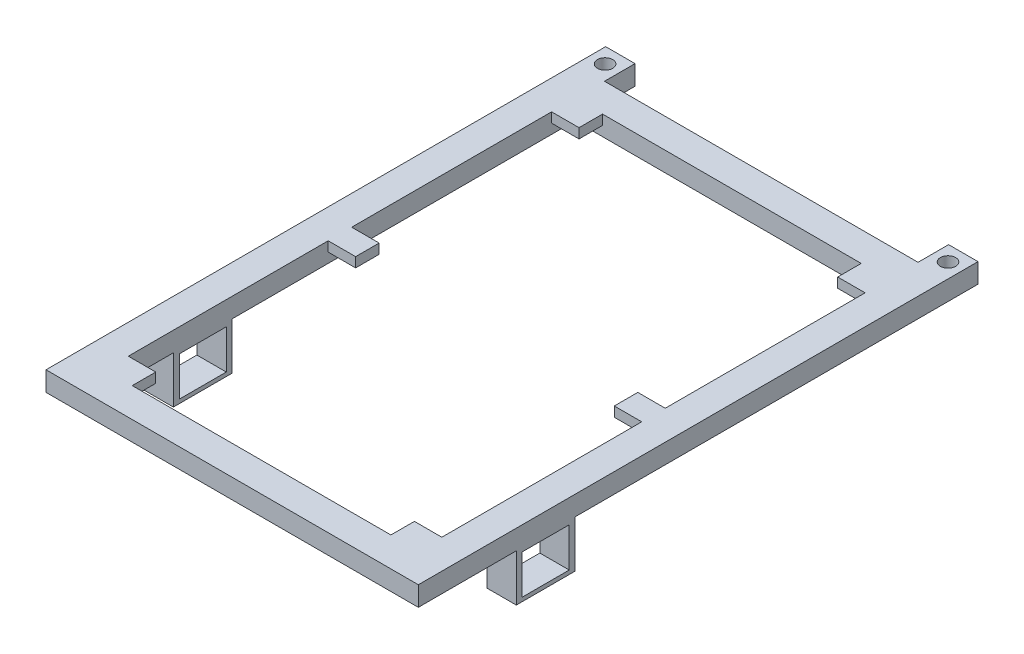
from build123d import *

# Parameters (mm, degrees)
SKETCH1_W           = 95
SKETCH1_H           = 135
BOSS_EXTRUDE1_DEPTH = 5
SKETCH3_W           = 80
SKETCH3_H           = 120
CUT_EXTRUDE1_DEPTH  = 99.930888994
SKETCH4_W           = 7
SKETCH4_H           = 6
BOSS_EXTRUDE4_DEPTH = 2.5
SKETCH6_W           = 7.5
SKETCH6_H           = 7.8
BOSS_EXTRUDE5_DEPTH = 5
SKETCH7_R           = 1.95
CUT_EXTRUDE2_DEPTH  = 10
SKETCH16_W          = 7.5
SKETCH16_H          = 15
BOSS_EXTRUDE9_DEPTH = 12
SKETCH18_W          = 12
SKETCH18_H          = 10
CUT_EXTRUDE3_DEPTH  = 1002


with BuildPart() as part:
    # Sketch1 → Boss-Extrude1 (new body)
    with BuildSketch(Plane(origin=(0, 0, 0), x_dir=(1, 0, 0), z_dir=(0, 1, 0))):
        with Locations((-15.327225131, -8.756544503)):
            Rectangle(SKETCH1_W, SKETCH1_H)
    extrude(amount=BOSS_EXTRUDE1_DEPTH)

    # Sketch3 → Cut-Extrude1 (cut, through all)
    with BuildSketch(Plane(origin=(0, 5, 0), x_dir=(1, 0, 0), z_dir=(0, 1, 0))):
        with Locations((-15.327225131, -8.756544503)):
            Rectangle(SKETCH3_W, SKETCH3_H)
    extrude(amount=-CUT_EXTRUDE1_DEPTH, mode=Mode.SUBTRACT)

    # Sketch4 → Boss-Extrude4 (add)
    with BuildSketch(Plane(origin=(0, 5, 0), x_dir=(1, 0, 0), z_dir=(0, 1, 0))):
        with Locations((-51.827225131, 48.243455497)):
            Rectangle(SKETCH4_W, SKETCH4_H)
        with Locations((21.172774869, -65.756544503)):
            Rectangle(SKETCH4_W, SKETCH4_H)
        with Locations((21.172774869, 48.243455497)):
            Rectangle(SKETCH4_W, SKETCH4_H)
        with Locations((-51.827225131, -65.756544503)):
            Rectangle(SKETCH4_W, SKETCH4_H)
        with Locations((-51.827225131, -8.756544503)):
            Rectangle(SKETCH4_W, SKETCH4_H)
        with Locations((21.172774869, -8.756544503)):
            Rectangle(SKETCH4_W, SKETCH4_H)
    extrude(amount=-BOSS_EXTRUDE4_DEPTH)

    # Sketch6 → Boss-Extrude5 (add)
    with BuildSketch(Plane.XZ):
        with Locations((28.422774869, -62.643455497)):
            Rectangle(SKETCH6_W, SKETCH6_H)
        with Locations((-59.077225131, -62.643455497)):
            Rectangle(SKETCH6_W, SKETCH6_H)
    extrude(amount=-BOSS_EXTRUDE5_DEPTH)

    # Sketch7 → Cut-Extrude2 (cut)
    with BuildSketch(Plane(origin=(0, 0, 0), x_dir=(-1, 0, 0), z_dir=(0, -1, 0))):
        with Locations(Location((59.077225131, 62.643455497, 0), (0, 0, 90))):
            Circle(SKETCH7_R)
        with Locations(Location((-28.422774869, 62.643455497, 0), (0, 0, 90))):
            Circle(SKETCH7_R)
    extrude(amount=-CUT_EXTRUDE2_DEPTH, mode=Mode.SUBTRACT)

    # Sketch16 → Boss-Extrude9 (add)
    with BuildSketch(Plane(origin=(0, 0, 0), x_dir=(-1, 0, 0), z_dir=(0, -1, 0))):
        with Locations((59.077225131, -43.756544503)):
            Rectangle(SKETCH16_W, SKETCH16_H)
        with Locations((-28.422774869, -43.756544503)):
            Rectangle(SKETCH16_W, SKETCH16_H)
    extrude(amount=BOSS_EXTRUDE9_DEPTH)

    # Sketch18 → Cut-Extrude3 (cut)
    with BuildSketch(Plane.ZY.offset(62.827225131)):
        with Locations((43.756544503, -6)):
            Rectangle(SKETCH18_W, SKETCH18_H)
    extrude(amount=-CUT_EXTRUDE3_DEPTH, mode=Mode.SUBTRACT)


solid = part.part
